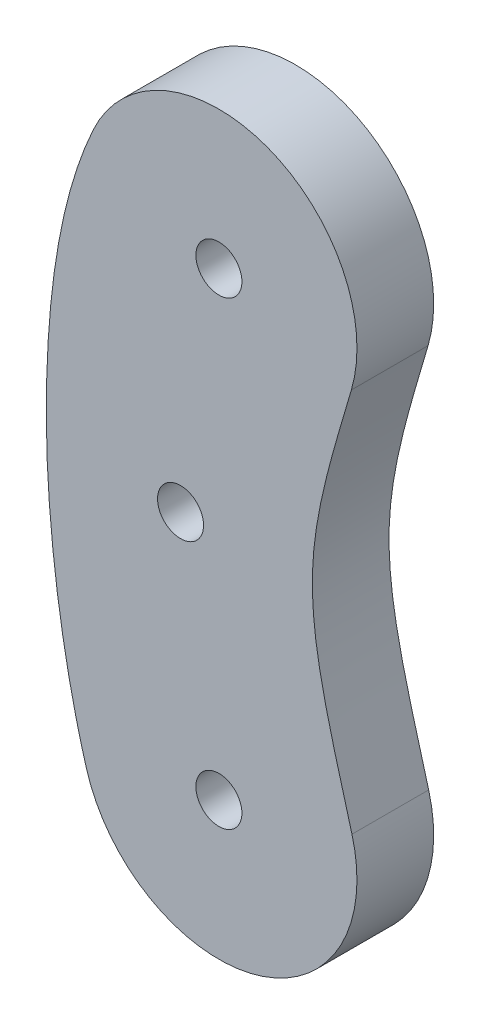
from build123d import *

# Parameters (mm, degrees)
SKETCH_1_R          = 9
EXTRUDE_1_DEPTH     = 5
SKETCH_2_R          = 1.5
CUT_EXTRUDE_1_DEPTH = 10
SKETCH_3_R          = 1.5
CUT_EXTRUDE_2_DEPTH = 10


with BuildPart() as part:
    # 草图1 → 凸台-拉伸1 (new body)
    with BuildSketch(Plane.XY):
        with BuildLine():
            ThreePointArc((-8.629267244, -2.556510674), (-2.479070596, 8.651832695), (8.673703204, 2.401431392))
            add(Edge.make_bspline(
                [(8.673703204, 2.401431392), (7.075929143, 8.172413663), (4.921999012, 15.324710847), (7.430404247, 23.369076832), (8.633989736, 27.459484061)],
                knots=[0, 0, 0, 0, 0.557287964, 1, 1, 1, 1], degree=3))
            ThreePointArc((8.633989736, 27.459484061), (-3.157797251, 21.572170118), (-8.17760204, 33.758566865))
            add(Edge.make_bspline(
                [(-8.17760204, 33.758566865), (-10.239121011, 29.273271712), (-11.449987144, 20.943264961), (-11.113666199, 8.883330205), (-9.769292032, 1.291538409), (-8.629267244, -2.556510674)],
                knots=[0, 0, 0, 0, 0.412769953, 0.64691545, 1, 1, 1, 1], degree=3))
        make_face()
        with Locations((0, 30)):
            Circle(SKETCH_1_R)
        Circle(SKETCH_1_R)
    extrude(amount=EXTRUDE_1_DEPTH)

    # 草图2 → 切除-拉伸1 (cut)
    with BuildSketch(Plane.XY.offset(5)):
        with Locations((0, 30)):
            Circle(SKETCH_2_R)
        Circle(SKETCH_2_R)
    extrude(amount=-CUT_EXTRUDE_1_DEPTH, mode=Mode.SUBTRACT)

    # 草图3 → 切除-拉伸2 (cut)
    with BuildSketch(Plane.XY.offset(5)):
        with Locations((-2.5, 15)):
            Circle(SKETCH_3_R)
    extrude(amount=-CUT_EXTRUDE_2_DEPTH, mode=Mode.SUBTRACT)


solid = part.part
